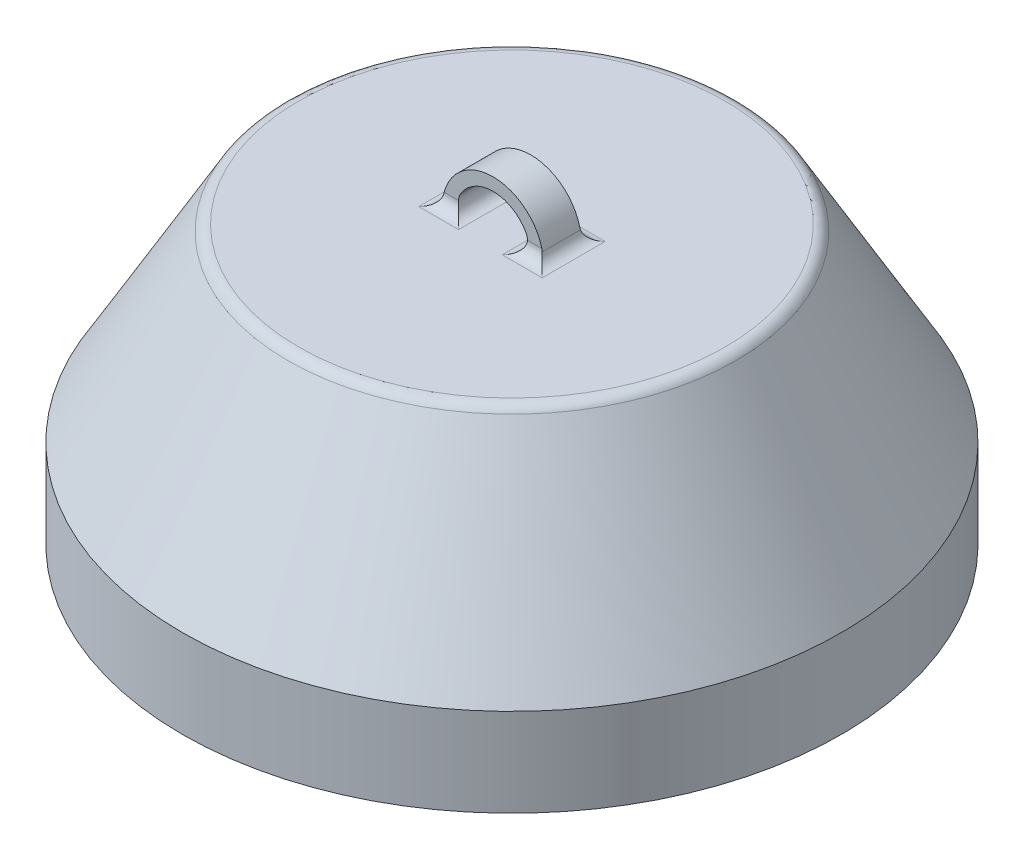
from build123d import *

# Parameters (mm, degrees)
SKETCH1_R           = 26.15
SKETCH1_R_2         = 24.65
BOSS_EXTRUDE1_DEPTH = 7
SKETCH3_R           = 26.15
BOSS_EXTRUDE2_DEPTH = 15
BOSS_EXTRUDE2_TAPER = 30
SKETCH4_R           = 24.65
CUT_EXTRUDE1_DEPTH  = 13.5
CUT_EXTRUDE1_DRAFT  = -30
BOSS_EXTRUDE4_DEPTH = 1.5
FILLET2_R           = 1


with BuildPart() as part:
    # Sketch1 → Boss-Extrude1 (new body)
    with BuildSketch(Plane(origin=(0, 0, 0), x_dir=(1, 0, 0), z_dir=(0, 1, 0))):
        with Locations(Location((0, 0, 0), (0, 0, 270))):
            Circle(SKETCH1_R)
        with Locations(Location((0, 0, 0), (0, 0, 270))):
            Circle(SKETCH1_R_2, mode=Mode.SUBTRACT)
    extrude(amount=BOSS_EXTRUDE1_DEPTH)

    # Sketch3 → Boss-Extrude2 (add)
    with BuildSketch(Plane(origin=(0, 7, 0), x_dir=(1, 0, 0), z_dir=(0, 1, 0))):
        with Locations(Location((0, 0, 0), (0, 0, 270))):
            Circle(SKETCH3_R)
    extrude(amount=BOSS_EXTRUDE2_DEPTH, taper=BOSS_EXTRUDE2_TAPER)


with BuildPart() as cut_extrude1_tool:
    # Sketch4 → Cut-Extrude1 (with draft: the straight prism first)
    with BuildSketch(Plane.XZ.offset(-7)):
        with Locations(Location((0, 0, 0), (0, 0, 270))):
            Circle(SKETCH4_R)
    extrude(amount=-CUT_EXTRUDE1_DEPTH)
    # Cut-Extrude1: the draft: its side faces are tilted about the plane it starts from
    cut_extrude1_sides = [cut_extrude1_tool.faces().sort_by_distance(p)[0] for p in [
        (0, 13.75, 24.65),
    ]]
    draft(cut_extrude1_sides, Plane.XZ.offset(-7), CUT_EXTRUDE1_DRAFT)


with BuildPart() as part_1:
    add(part.part)

    # Cut-Extrude1: cut by cut_extrude1_tool
    add(cut_extrude1_tool.part, mode=Mode.SUBTRACT)

    # Sketch5 → Boss-Extrude4 (add, symmetric)
    with BuildSketch(Plane.XY):
        with BuildLine():
            Line((-4, 22), (-3, 22))
            ThreePointArc((-3, 22), (0, 25), (3, 22))
            Line((3, 22), (4, 22))
            ThreePointArc((4, 22), (0, 26), (-4, 22))
        make_face()
    extrude(amount=BOSS_EXTRUDE4_DEPTH, both=True)

    # Fillet2
    fillet2_edges = [part_1.edges().sort_by_distance(p)[0] for p in [
        (0, 22, -17.489745962),
        (4, 22, 0),
        (-3.5, 22, -1.5),
        (-4, 22, 0),
        (-3, 22, 0),
        (3.5, 22, -1.5),
        (3, 22, 0),
        (-3.5, 22, 1.5),
        (3.5, 22, 1.5),
    ]]
    fillet(fillet2_edges, radius=FILLET2_R)


solid = part_1.part
